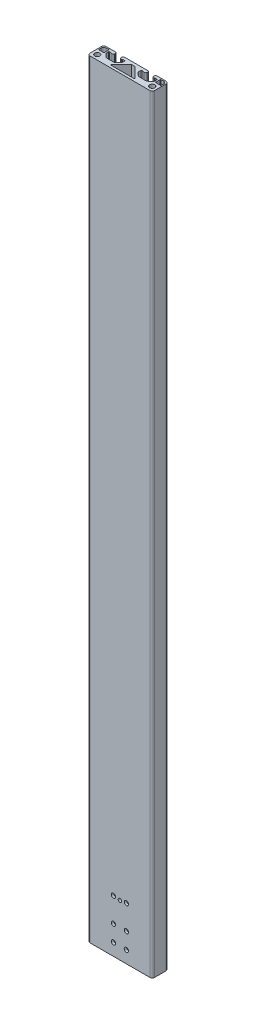
from build123d import *

# Parameters (mm, degrees)
SKETCH1_R                = 3.175
BOSS_EXTRUDE1_DEPTH      = 950
M5_CLEARANCE_HOLE1_D     = 5.3
M5_CLEARANCE_HOLE1_DEPTH = 5
M5_CLEARANCE_HOLE1_TIP   = 1.59228064
M5X0_8_TAPPED_HOLE1_D    = 4.2


with BuildPart() as part:
    # Sketch1 → Boss-Extrude1 (new body)
    with BuildSketch(Plane.XZ):
        with BuildLine():
            Line((77, 0), (3, 0))
            ThreePointArc((3, 0), (0.878679656, -0.878679656), (0, -3))
            Line((0, -3), (0, -17))
            ThreePointArc((0, -17), (0.878679656, -19.121320344), (3, -20))
            Line((3, -20), (14.5, -20))
            ThreePointArc((14.5, -20), (15.560660172, -19.560660172), (16, -18.5))
            Line((16, -18.5), (16, -17.5))
            ThreePointArc((16, -17.5), (15.560660172, -16.439339828), (14.5, -16))
            Line((14.5, -16), (13.2, -16))
            Line((13.2, -16), (13.2, -16.5))
            Line((13.2, -16.5), (10.75, -16.5))
            ThreePointArc((10.75, -16.5), (10.219669914, -16.280330086), (10, -15.75))
            Line((10, -15.75), (10, -12.810660172))
            ThreePointArc((10, -12.810660172), (10.057090351, -12.523647598), (10.219669914, -12.280330086))
            Line((10.219669914, -12.280330086), (13.108757211, -9.391242789))
            ThreePointArc((13.108757211, -9.391242789), (14.649768118, -8.361572221), (16.467514421, -8))
            Line((16.467514421, -8), (23.532485579, -8))
            ThreePointArc((23.532485579, -8), (25.350231882, -8.361572221), (26.891242789, -9.391242789))
            Line((26.891242789, -9.391242789), (29.780330086, -12.280330086))
            ThreePointArc((29.780330086, -12.280330086), (29.942909649, -12.523647598), (30, -12.810660172))
            Line((30, -12.810660172), (30, -15.75))
            ThreePointArc((30, -15.75), (29.780330086, -16.280330086), (29.25, -16.5))
            Line((29.25, -16.5), (26.8, -16.5))
            Line((26.8, -16.5), (26.8, -16))
            Line((26.8, -16), (25.5, -16))
            ThreePointArc((25.5, -16), (24.439339828, -16.439339828), (24, -17.5))
            Line((24, -17.5), (24, -18.5))
            ThreePointArc((24, -18.5), (24.439339828, -19.560660172), (25.5, -20))
            Line((25.5, -20), (54.5, -20))
            ThreePointArc((54.5, -20), (55.560660172, -19.560660172), (56, -18.5))
            Line((56, -18.5), (56, -17.5))
            ThreePointArc((56, -17.5), (55.560660172, -16.439339828), (54.5, -16))
            Line((54.5, -16), (53.2, -16))
            Line((53.2, -16), (53.2, -16.5))
            Line((53.2, -16.5), (50.75, -16.5))
            ThreePointArc((50.75, -16.5), (50.219669914, -16.280330086), (50, -15.75))
            Line((50, -15.75), (50, -12.810660172))
            ThreePointArc((50, -12.810660172), (50.057090351, -12.523647598), (50.219669914, -12.280330086))
            Line((50.219669914, -12.280330086), (53.108757211, -9.391242789))
            ThreePointArc((53.108757211, -9.391242789), (54.649768118, -8.361572221), (56.467514421, -8))
            Line((56.467514421, -8), (63.532485579, -8))
            ThreePointArc((63.532485579, -8), (65.350231882, -8.361572221), (66.891242789, -9.391242789))
            Line((66.891242789, -9.391242789), (69.780330086, -12.280330086))
            ThreePointArc((69.780330086, -12.280330086), (69.942909649, -12.523647598), (70, -12.810660172))
            Line((70, -12.810660172), (70, -15.75))
            ThreePointArc((70, -15.75), (69.780330086, -16.280330086), (69.25, -16.5))
            Line((69.25, -16.5), (66.8, -16.5))
            Line((66.8, -16.5), (66.8, -16))
            Line((66.8, -16), (65.5, -16))
            ThreePointArc((65.5, -16), (64.439339828, -16.439339828), (64, -17.5))
            Line((64, -17.5), (64, -18.5))
            ThreePointArc((64, -18.5), (64.439339828, -19.560660172), (65.5, -20))
            Line((65.5, -20), (77, -20))
            ThreePointArc((77, -20), (79.121320344, -19.121320344), (80, -17))
            Line((80, -17), (80, -3))
            ThreePointArc((80, -3), (79.121320344, -0.878679656), (77, 0))
        make_face()
        with Locations(Location((6, -6, 0), (0, 0, 270))):
            Circle(SKETCH1_R, mode=Mode.SUBTRACT)
        with Locations(Location((74, -6, 0), (0, 0, 270))):
            Circle(SKETCH1_R, mode=Mode.SUBTRACT)
        with BuildLine():
            Line((7.45, -18.5), (4.3, -18.5))
            ThreePointArc((4.3, -18.5), (2.320101013, -17.679898987), (1.5, -15.7))
            Line((1.5, -15.7), (1.5, -12.75))
            ThreePointArc((1.5, -12.75), (1.719669914, -12.219669914), (2.25, -12))
            Line((2.25, -12), (7.45, -12))
            ThreePointArc((7.45, -12), (7.980330086, -12.219669914), (8.2, -12.75))
            Line((8.2, -12.75), (8.2, -17.75))
            ThreePointArc((8.2, -17.75), (7.980330086, -18.280330086), (7.45, -18.5))
        make_face(mode=Mode.SUBTRACT)
        with BuildLine():
            Line((54.546446609, -3.853553391), (41.9, -16.5))
            Line((41.9, -16.5), (38.1, -16.5))
            Line((38.1, -16.5), (25.453553391, -3.853553391))
            ThreePointArc((25.453553391, -3.853553391), (25.345167015, -3.308658284), (25.807106781, -3))
            Line((25.807106781, -3), (54.192893219, -3))
            ThreePointArc((54.192893219, -3), (54.654832985, -3.308658284), (54.546446609, -3.853553391))
        make_face(mode=Mode.SUBTRACT)
        with BuildLine():
            Line((71.8, -17.75), (71.8, -12.75))
            ThreePointArc((71.8, -12.75), (72.019669914, -12.219669914), (72.55, -12))
            Line((72.55, -12), (77.75, -12))
            ThreePointArc((77.75, -12), (78.280330086, -12.219669914), (78.5, -12.75))
            Line((78.5, -12.75), (78.5, -15.7))
            ThreePointArc((78.5, -15.7), (77.679898987, -17.679898987), (75.7, -18.5))
            Line((75.7, -18.5), (72.55, -18.5))
            ThreePointArc((72.55, -18.5), (72.019669914, -18.280330086), (71.8, -17.75))
        make_face(mode=Mode.SUBTRACT)
    extrude(amount=-BOSS_EXTRUDE1_DEPTH)

    # M5 Clearance Hole1
    with Locations(Plane.XY):
        with Locations((48, 15), (48, 35), (48, 65), (32, 65), (32, 35), (32, 15)):
            Hole(M5_CLEARANCE_HOLE1_D / 2, depth=M5_CLEARANCE_HOLE1_DEPTH)
            with Locations((0, 0, -(M5_CLEARANCE_HOLE1_DEPTH + M5_CLEARANCE_HOLE1_TIP / 2))):  # 118° drill point
                Cone(0, M5_CLEARANCE_HOLE1_D / 2, M5_CLEARANCE_HOLE1_TIP, mode=Mode.SUBTRACT)

    # M5x0.8 Tapped Hole1 (through all)
    with Locations(Plane(origin=(0, 0, -20), x_dir=(-1, 0, 0), z_dir=(0, 0, -1))):
        with Locations((-40, 64.001015899)):
            Hole(M5X0_8_TAPPED_HOLE1_D / 2)


solid = part.part
